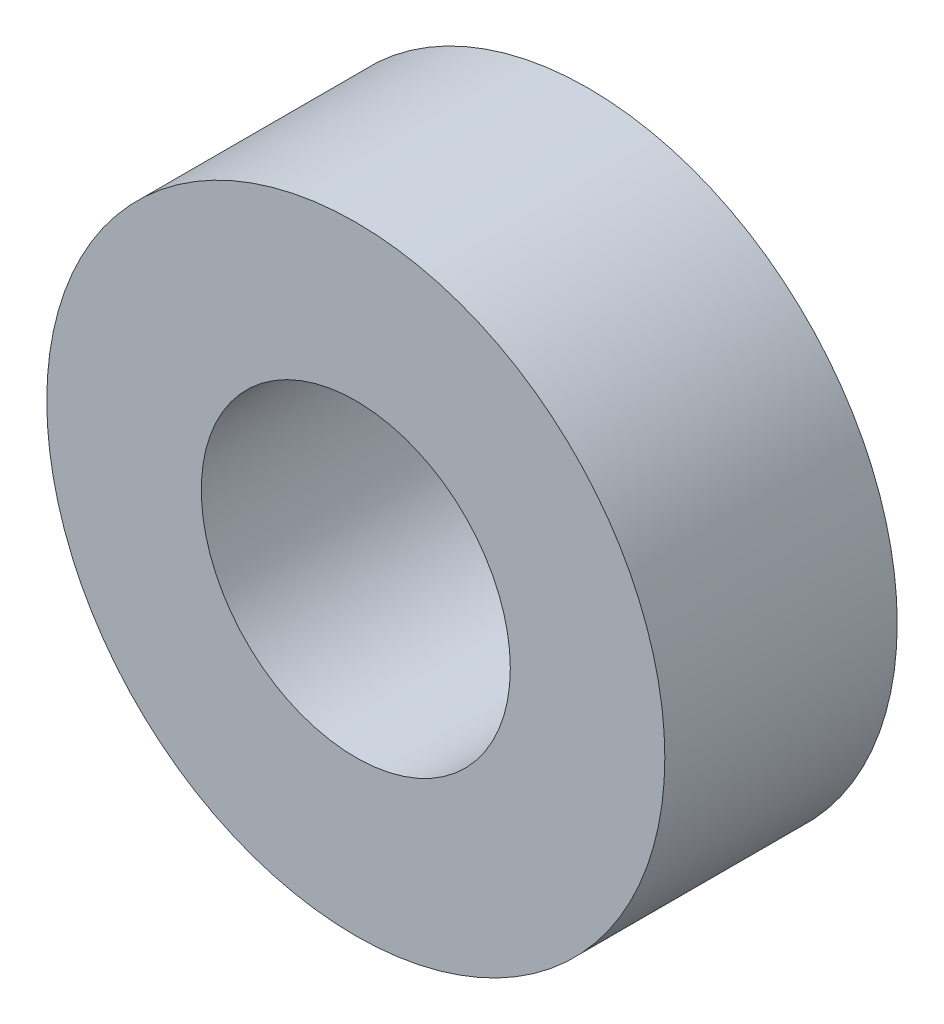
from build123d import *

# Parameters (mm, degrees)
SKETCH1_R           = 6.35
SKETCH1_R_2         = 3.175
BOSS_EXTRUDE1_DEPTH = 4.7752


with BuildPart() as part:
    # Sketch1 → Boss-Extrude1 (new body)
    with BuildSketch(Plane.XY):
        Circle(SKETCH1_R)
        Circle(SKETCH1_R_2, mode=Mode.SUBTRACT)
    extrude(amount=BOSS_EXTRUDE1_DEPTH)


solid = part.part
